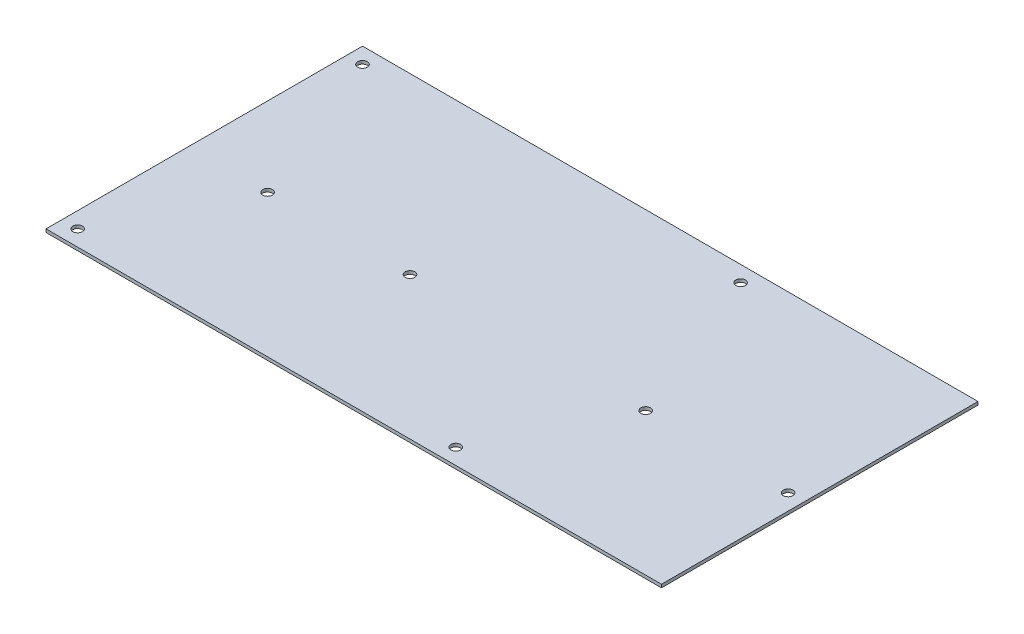
from build123d import *

# Parameters (mm, degrees)
SKETCH1_W           = 194.45
SKETCH1_H           = 100
SKETCH1_R           = 1.524
BOSS_EXTRUDE2_DEPTH = 1


with BuildPart() as part:
    # Sketch1 → Boss-Extrude2 (new body)
    with BuildSketch(Plane(origin=(0, 0, 0), x_dir=(1, 0, 0), z_dir=(0, 1, 0))):
        with Locations((97.225, 50)):
            Rectangle(SKETCH1_W, SKETCH1_H)
        with Locations(Location((5, 95, 0), (0, 0, 270))):
            Circle(SKETCH1_R, mode=Mode.SUBTRACT)
        with Locations(Location((70, 45, 0), (0, 0, 270))):
            Circle(SKETCH1_R, mode=Mode.SUBTRACT)
        with Locations(Location((5, 5, 0), (0, 0, 270))):
            Circle(SKETCH1_R, mode=Mode.SUBTRACT)
        with Locations(Location((25, 45, 0), (0, 0, 270))):
            Circle(SKETCH1_R, mode=Mode.SUBTRACT)
        with Locations(Location((124.45, 95, 0), (0, 0, 270))):
            Circle(SKETCH1_R, mode=Mode.SUBTRACT)
        with Locations(Location((189.45, 45, 0), (0, 0, 270))):
            Circle(SKETCH1_R, mode=Mode.SUBTRACT)
        with Locations(Location((124.45, 5, 0), (0, 0, 270))):
            Circle(SKETCH1_R, mode=Mode.SUBTRACT)
        with Locations(Location((144.45, 45, 0), (0, 0, 270))):
            Circle(SKETCH1_R, mode=Mode.SUBTRACT)
    extrude(amount=BOSS_EXTRUDE2_DEPTH)


solid = part.part
